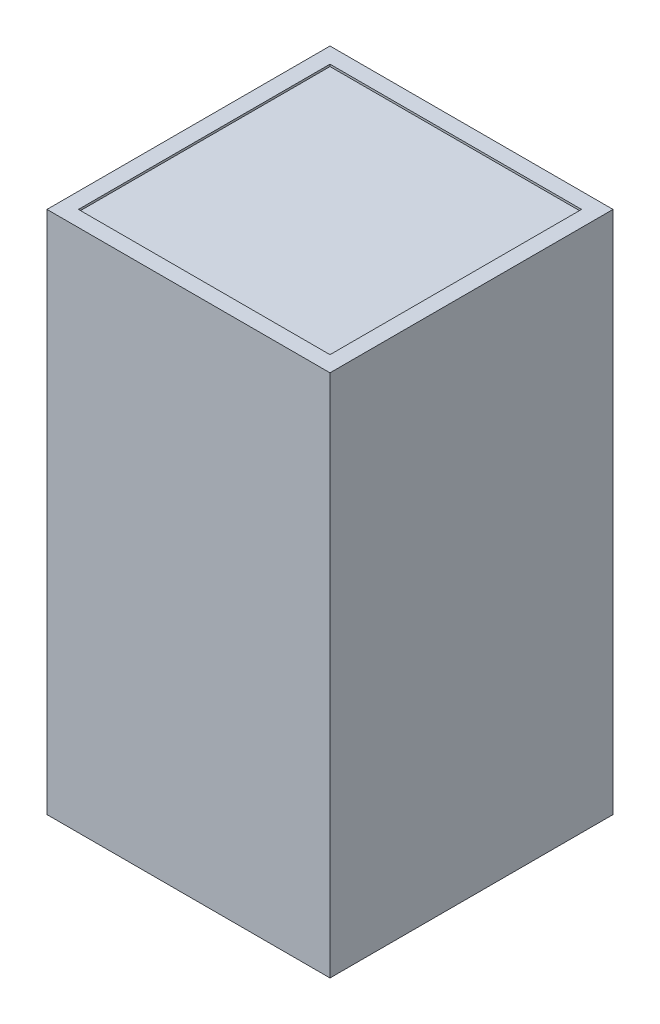
from build123d import *

# Parameters (mm, degrees)
SKETCH2_W           = 270
SKETCH2_H           = 270
BOSS_EXTRUDE1_DEPTH = 500
SKETCH4_W           = 240
SKETCH4_H           = 240
CUT_EXTRUDE2_DEPTH  = 2


with BuildPart() as part:
    # Sketch2 → Boss-Extrude1 (new body)
    with BuildSketch(Plane(origin=(0, 0, 0), x_dir=(1, 0, 0), z_dir=(0, 1, 0))):
        with Locations((135, 135)):
            Rectangle(SKETCH2_W, SKETCH2_H)
    extrude(amount=BOSS_EXTRUDE1_DEPTH)

    # Sketch4 → Cut-Extrude2 (cut)
    with BuildSketch(Plane(origin=(0, 500, 0), x_dir=(1, 0, 0), z_dir=(0, 1, 0))):
        with Locations((135, 135)):
            Rectangle(SKETCH4_W, SKETCH4_H)
    extrude(amount=-CUT_EXTRUDE2_DEPTH, mode=Mode.SUBTRACT)


solid = part.part
